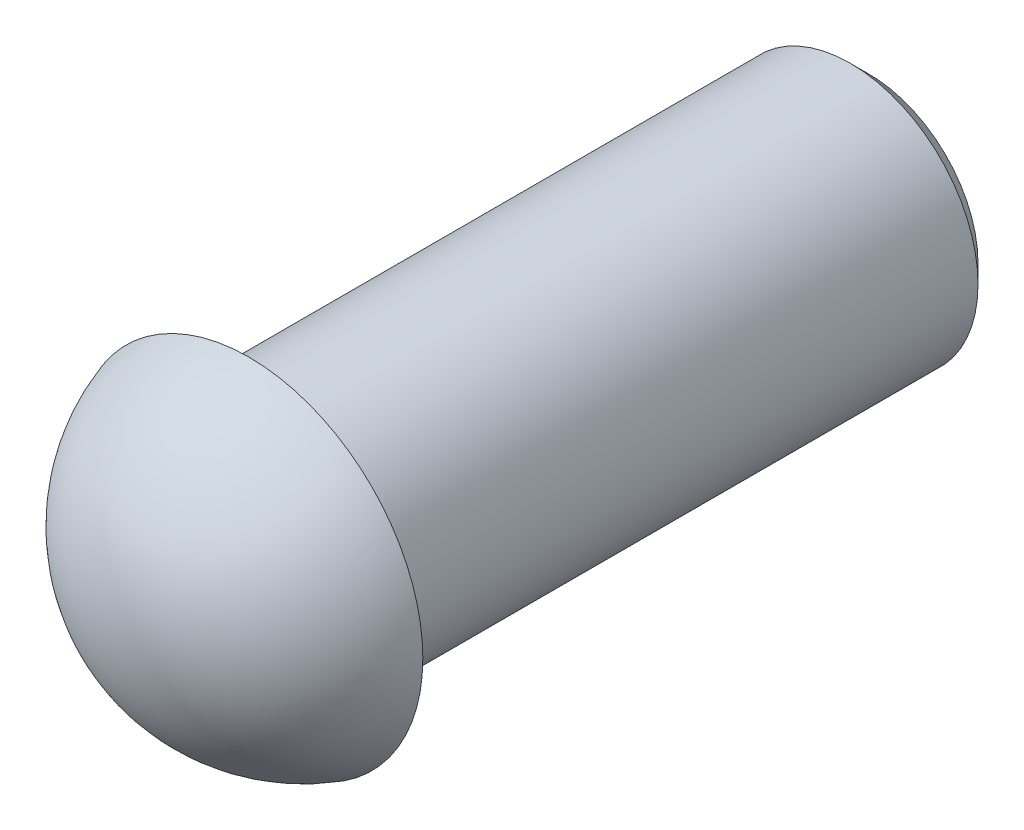
from build123d import *

# Parameters (mm, degrees)
ESQUISSE1_R          = 3.5
BASE_EXTRUSION_DEPTH = 17
CHANFREIN1_SIZE      = 0.5


with BuildPart() as part:
    # Esquisse1 → Base-Extrusion (new body)
    with BuildSketch(Plane.XY):
        Circle(ESQUISSE1_R)
    extrude(amount=-BASE_EXTRUSION_DEPTH)

    # Esquisse3 → Boss.-Révol.1 (revolve)
    with BuildSketch(Plane(origin=(0, 0, 0), x_dir=(0, 0, -1), z_dir=(1, 0, 0))):
        with BuildLine():
            Line((0, 0), (0, 4.769696007))
            ThreePointArc((0, 4.769696007), (-2.531128874, 2.958039892), (-3.5, 0))
            Line((-3.5, 0), (0, 0))
        make_face()
    revolve(axis=Axis((0, 0, 0), (0, 0, -1)))

    # Chanfrein1
    chanfrein1_edges = [part.edges().sort_by_distance(p)[0] for p in [
        (-3.5, 0, -17),
    ]]
    chamfer(chanfrein1_edges, length=CHANFREIN1_SIZE)


solid = part.part
